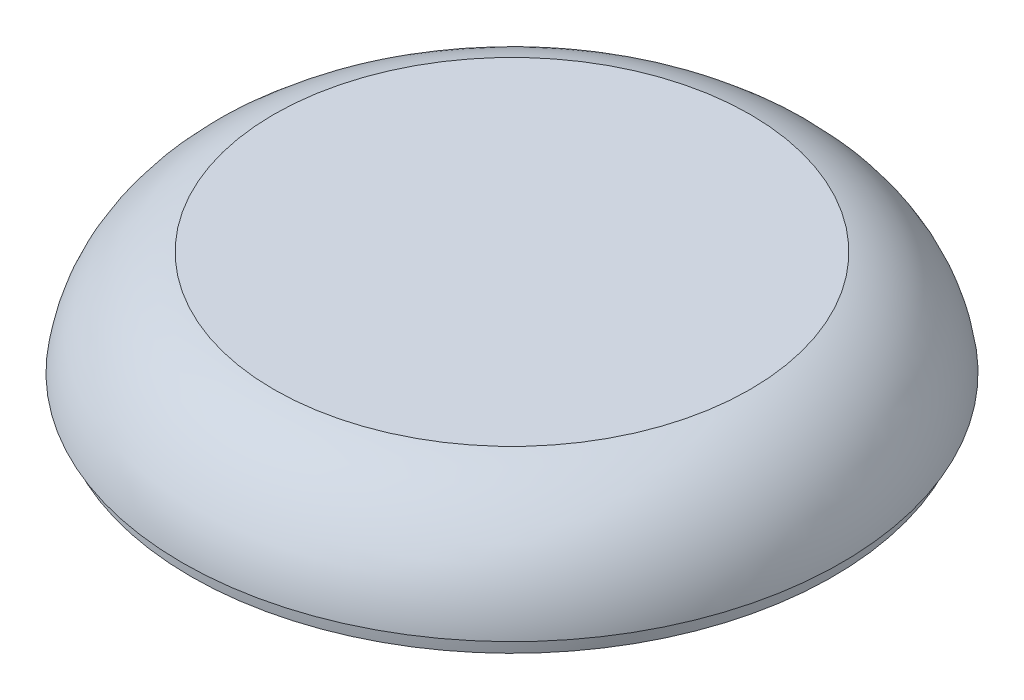
from build123d import *


with BuildPart() as part:
    # Sketch1 → Revolve3 (revolve)
    with BuildSketch(Plane.XY, mode=Mode.PRIVATE) as revolve3_sk:
        with BuildLine():
            Line((0, 0), (1, 0))
            ThreePointArc((1, 0), (1.012509778, -1.000312842), (1.050031289, -2))
            Line((1.050031289, -2), (2.051315812, -2))
            ThreePointArc((2.051315812, -2), (2.012831064, -1.00032911), (2, 0))
            ThreePointArc((2, 0), (5.180088034, 6.896539681), (11.570458359, 11))
            Line((11.570458359, 11), (41, 11))
            Line((41, 11), (41, 13))
            Line((41, 13), (11.364514255, 13))
            ThreePointArc((11.364514255, 13), (3.709713219, 8.224384875), (0, 0))
        make_face()
    revolve(revolve3_sk.sketch.rotate(Axis((41, 13, 0), (0, -1, 0)), 270), axis=Axis((41, 13, 0), (0, -1, 0)))


solid = part.part
